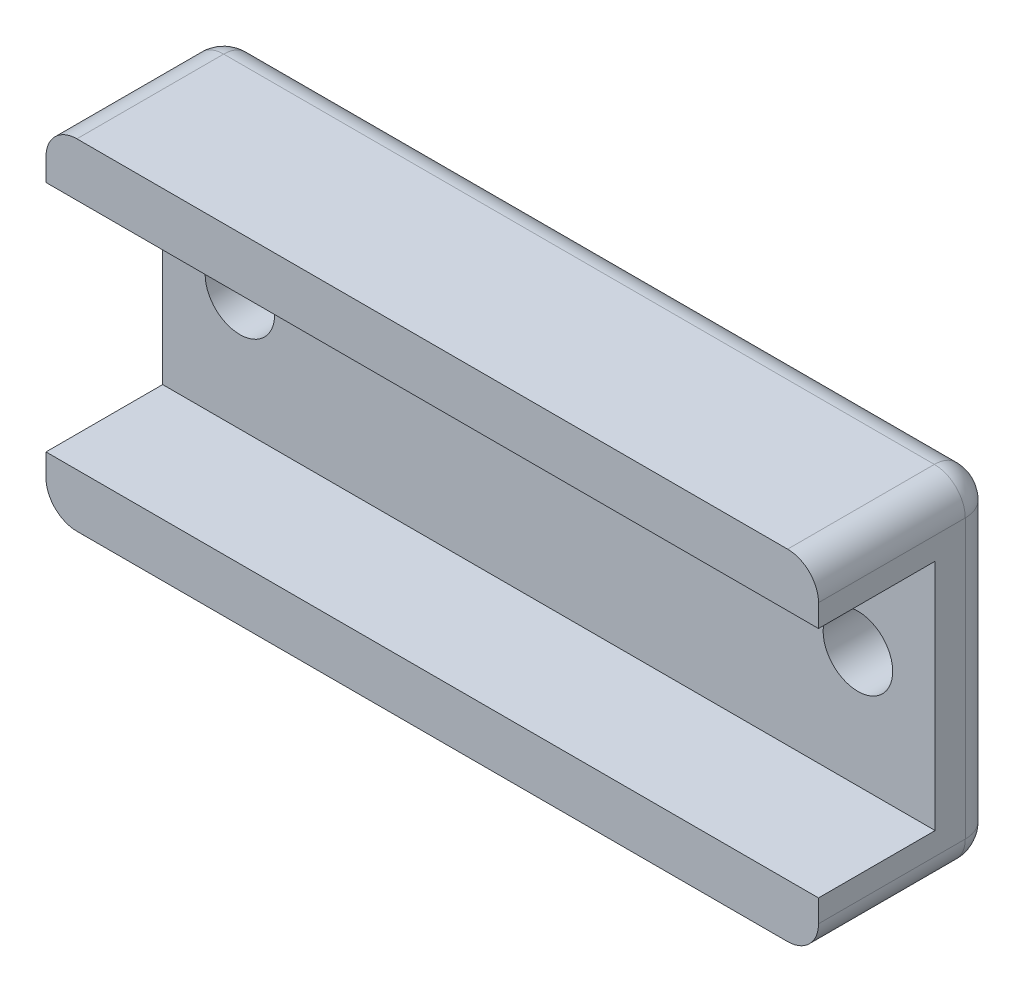
from build123d import *

# Parameters (mm, degrees)
SKETCH_1_W          = 50
SKETCH_1_H          = 22
EXTRUDE_1_DEPTH     = 23
SKETCH_2_W          = 15.1
SKETCH_2_H          = 15.1
CUT_EXTRUDE_1_DEPTH = 77
SKETCH_3_R          = 2.25
CUT_EXTRUDE_2_DEPTH = 49
SKETCH_4_W          = 50
SKETCH_4_H          = 11.5
CUT_EXTRUDE_3_DEPTH = 49
FILLET_1_R          = 2
FILLET_2_R          = 2


with BuildPart() as part:
    # 草图1 → 凸台-拉伸1 (new body)
    with BuildSketch(Plane.XY):
        with Locations((25, -11)):
            Rectangle(SKETCH_1_W, SKETCH_1_H)
    extrude(amount=EXTRUDE_1_DEPTH)

    # 草图2 → 切除-拉伸1 (cut)
    with BuildSketch(Plane(origin=(50, 0, 0), x_dir=(0, 0, -1), z_dir=(1, 0, 0))):
        with Locations((-11.5, -11)):
            Rectangle(SKETCH_2_W, SKETCH_2_H)
    extrude(amount=-CUT_EXTRUDE_1_DEPTH, mode=Mode.SUBTRACT)

    # 草图3 → 切除-拉伸2 (cut)
    with BuildSketch(Plane(origin=(0, 0, 0), x_dir=(-1, 0, 0), z_dir=(0, 0, -1))):
        with Locations((-45, -11)):
            Circle(SKETCH_3_R)
        with Locations((-5, -11)):
            Circle(SKETCH_3_R)
    extrude(amount=-CUT_EXTRUDE_2_DEPTH, mode=Mode.SUBTRACT)

    # 草图4 → 切除-拉伸3 (cut)
    with BuildSketch(Plane.XZ.offset(22)):
        with Locations((25, 17.25)):
            Rectangle(SKETCH_4_W, SKETCH_4_H)
    extrude(amount=-CUT_EXTRUDE_3_DEPTH, mode=Mode.SUBTRACT)

    # 圆角1
    fillet_1_edges = [part.edges().sort_by_distance(p)[0] for p in [
        (25, 0, 0),
        (25, -22, 0),
    ]]
    fillet(fillet_1_edges, radius=FILLET_1_R)

    # 圆角2
    fillet_2_edges = [part.edges().sort_by_distance(p)[0] for p in [
        (0, 0, 6.75),
        (50, 0, 6.75),
        (50, -22, 6.75),
        (0, -22, 6.75),
        (0, -11, 0),
        (0, -21.414213562, 0.585786438),
        (0, -0.585786438, 0.585786438),
        (50, -11, 0),
        (50, -21.414213562, 0.585786438),
        (50, -0.585786438, 0.585786438),
    ]]
    fillet(fillet_2_edges, radius=FILLET_2_R)


solid = part.part
